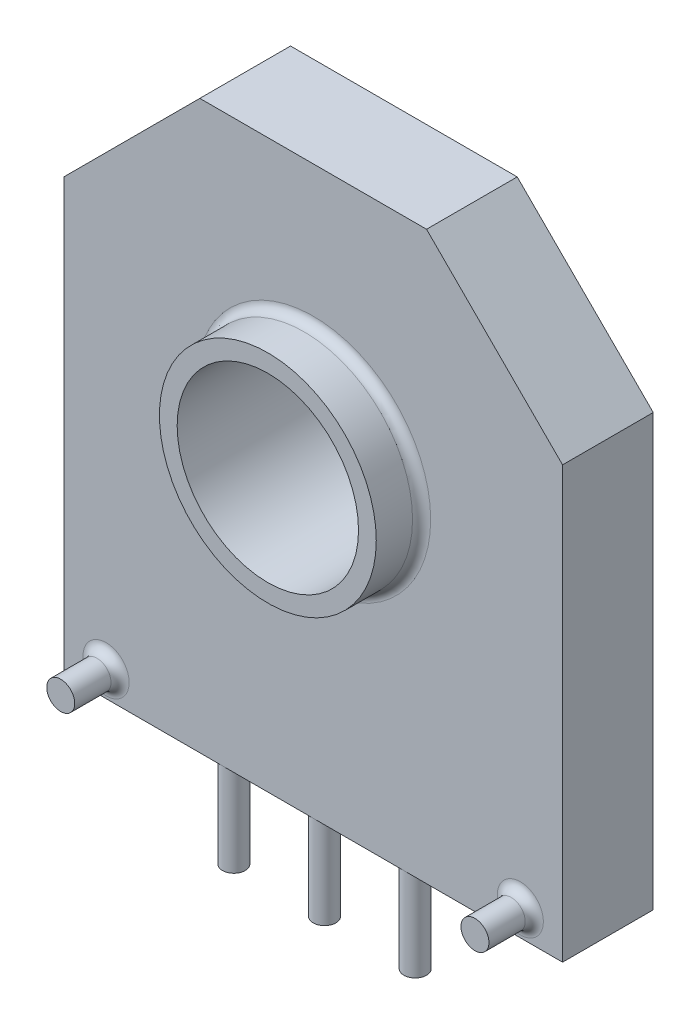
from build123d import *

# Parameters (mm, degrees)
SKETCH1_R           = 2
BOSS_EXTRUDE1_DEPTH = 2
SKETCH2_R           = 2.391473365
SKETCH2_R_2         = 2
SKETCH2_R_3         = 0.308853545
BOSS_EXTRUDE2_DEPTH = 1
FILLET1_R           = 0.2
SKETCH3_R           = 0.25
BOSS_EXTRUDE3_DEPTH = 2


with BuildPart() as part:
    # Sketch1 → Boss-Extrude1 (new body)
    with BuildSketch(Plane.XY):
        Polygon((0, -7), (5.5, -7), (5.5, 2.5), (2.5, 5.5), (-2.5, 5.5), (-5.5, 2.5), (-5.5, -7), align=None)
        Circle(SKETCH1_R, mode=Mode.SUBTRACT)
    extrude(amount=BOSS_EXTRUDE1_DEPTH)

    # Sketch2 → Boss-Extrude2 (add)
    # profile 1 of 3: a face of its own
    with BuildSketch(Plane.XY.offset(2)):
        Circle(SKETCH2_R)
        Circle(SKETCH2_R_2, mode=Mode.SUBTRACT)
    # profile 2 of 3: a face of its own
    with BuildSketch(Plane.XY.offset(2)):
        with Locations((-4.567781371, -6.437447931)):
            Circle(SKETCH2_R_3)
    # profile 3 of 3: a face of its own
    with BuildSketch(Plane.XY.offset(2)):
        with Locations(Location((4.567781371, -6.437447931, 0), (0, 0, 180))):
            Circle(SKETCH2_R_3)
    extrude(amount=BOSS_EXTRUDE2_DEPTH)

    # Fillet1
    fillet1_edges = [part.edges().sort_by_distance(p)[0] for p in [
        (-2.391473365, 0, 2),
        (-4.876634915, -6.437447931, 2),
        (4.876634915, -6.437447931, 2),
    ]]
    fillet(fillet1_edges, radius=FILLET1_R)

    # Sketch3 → Boss-Extrude3 (add)
    with BuildSketch(Plane.XZ.offset(7)):
        with Locations(Location((0, 1.75, 0), (0, 0, 90))):
            Circle(SKETCH3_R)
        with Locations(Location((2, 1.75, 0), (0, 0, 90))):
            Circle(SKETCH3_R)
        with Locations(Location((-2, 1.75, 0), (0, 0, 180))):
            Circle(SKETCH3_R)
    extrude(amount=BOSS_EXTRUDE3_DEPTH)


solid = part.part
